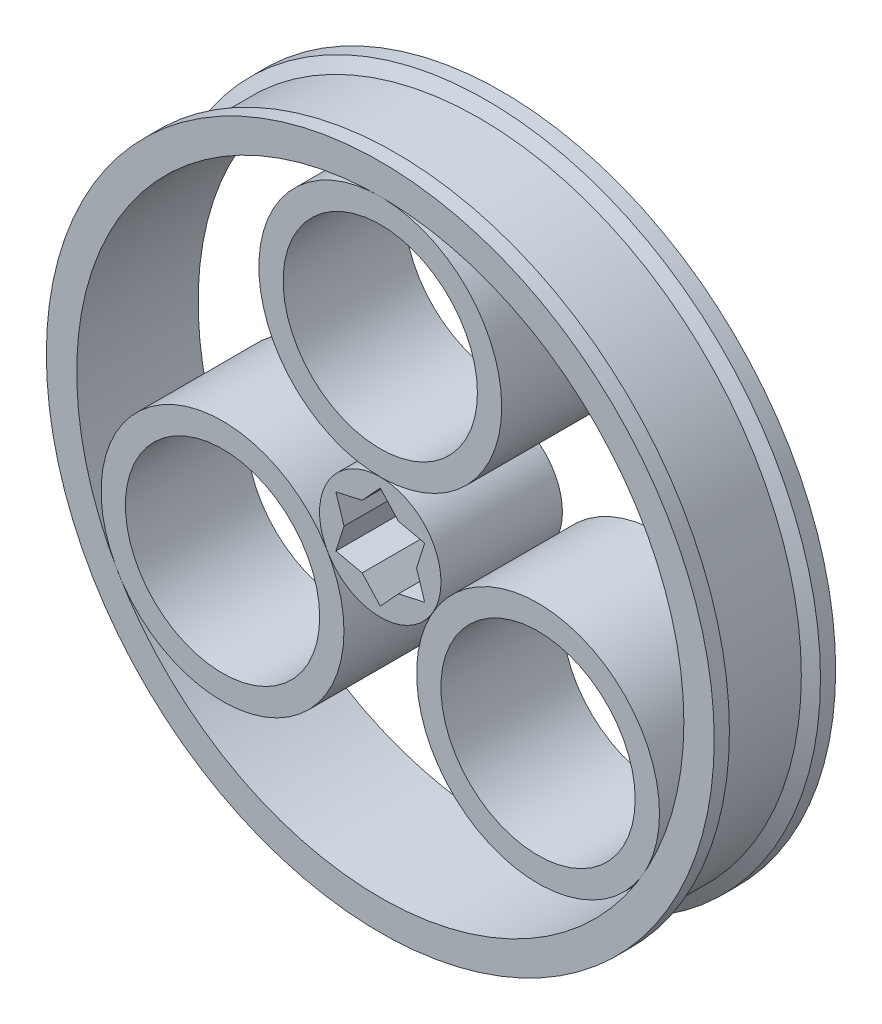
from build123d import *

# Parameters (mm, degrees)
SKETCH1_R             = 10
SKETCH1_R_2           = 8
BOSS_EXTRUDE1_DEPTH   = 10
BOSS_EXTRUDE1_2_DEPTH = 10
BOSS_EXTRUDE1_3_DEPTH = 10
SKETCH1_R_3           = 27.5
SKETCH1_R_4           = 25
BOSS_EXTRUDE1_4_DEPTH = 10
SKETCH1_R_5           = 5
BOSS_EXTRUDE1_5_DEPTH = 10
CUT_EXTRUDE1_DEPTH    = 10
CUT_EXTRUDE2_DEPTH    = 10


with BuildPart() as part:
    # Sketch1 → Boss-Extrude1 (new body)
    with BuildSketch(Plane.XY):
        with Locations((0, 15)):
            Circle(SKETCH1_R)
        with Locations((0, 15)):
            Circle(SKETCH1_R_2, mode=Mode.SUBTRACT)
    extrude(amount=BOSS_EXTRUDE1_DEPTH)


with BuildPart() as body_2:
    # Sketch1 → Boss-Extrude1 2 (new body)
    with BuildSketch(Plane.XY):
        with Locations((-12.990381057, -7.5)):
            Circle(SKETCH1_R)
        with Locations((-12.990381057, -7.5)):
            Circle(SKETCH1_R_2, mode=Mode.SUBTRACT)
    extrude(amount=BOSS_EXTRUDE1_2_DEPTH)


with BuildPart() as body_3:
    # Sketch1 → Boss-Extrude1 3 (new body)
    with BuildSketch(Plane.XY):
        with Locations((12.990381057, -7.5)):
            Circle(SKETCH1_R)
        with Locations((12.990381057, -7.5)):
            Circle(SKETCH1_R_2, mode=Mode.SUBTRACT)
    extrude(amount=BOSS_EXTRUDE1_3_DEPTH)


with BuildPart() as body_4:
    # Sketch1 → Boss-Extrude1 4 (new body)
    with BuildSketch(Plane.XY):
        Circle(SKETCH1_R_3)
        Circle(SKETCH1_R_4, mode=Mode.SUBTRACT)
    extrude(amount=BOSS_EXTRUDE1_4_DEPTH)

    # Sketch3 → Cut-Revolve1 (revolve, cut)
    with BuildSketch(Plane(origin=(0, 0, 0), x_dir=(0, 0, -1), z_dir=(1, 0, 0)), mode=Mode.PRIVATE) as cut_revolve1_sk:
        Polygon((-8.75, 27.5), (-8.172649731, 26.5), (-1.827350269, 26.5), (-1.25, 27.5), align=None)
    revolve(cut_revolve1_sk.sketch.rotate(Axis((0, 0, 5), (0, 0, -1)), 90), axis=Axis((0, 0, 5), (0, 0, -1)), mode=Mode.SUBTRACT)


with BuildPart() as body_5:
    # Sketch1 → Boss-Extrude1 5 (new body)
    with BuildSketch(Plane.XY):
        Circle(SKETCH1_R_5)
    extrude(amount=BOSS_EXTRUDE1_5_DEPTH)

    # Sketch2 → Cut-Extrude1 (cut)
    with BuildSketch(Plane(origin=(0, 0, 0), x_dir=(-1, 0, 0), z_dir=(0, 0, -1))):
        Polygon((0, -3.922496167), (1.389301091, -2.406340076), (3.396981327, -1.961248084), (2.778602182, 0), (3.396981327, 1.961248084), (1.389301091, 2.406340076), (0, 3.922496167), (-1.389301091, 2.406340076), (-3.396981327, 1.961248084), (-2.778602182, 0), (-3.396981327, -1.961248084), (-1.389301091, -2.406340076), align=None)
    extrude(amount=-CUT_EXTRUDE1_DEPTH, mode=Mode.SUBTRACT)

    # Sketch5 → Cut-Extrude2 (cut)
    with BuildSketch(Plane(origin=(0, 0, 0), x_dir=(-1, 0, 0), z_dir=(0, 0, -1))):
        Polygon((-3.653357276, 2.109266807), (-2.988308007, 0), (-3.653357276, -2.109266807), (-1.494154003, -2.587950648), (0, -4.218533614), (1.494154003, -2.587950648), (3.653357276, -2.109266807), (2.988308007, 0), (3.653357276, 2.109266807), (1.494154003, 2.587950648), (0, 4.218533614), (-1.494154003, 2.587950648), align=None)
    extrude(amount=-CUT_EXTRUDE2_DEPTH, mode=Mode.SUBTRACT)


solid = Compound([part.part, body_2.part, body_3.part, body_4.part, body_5.part])
